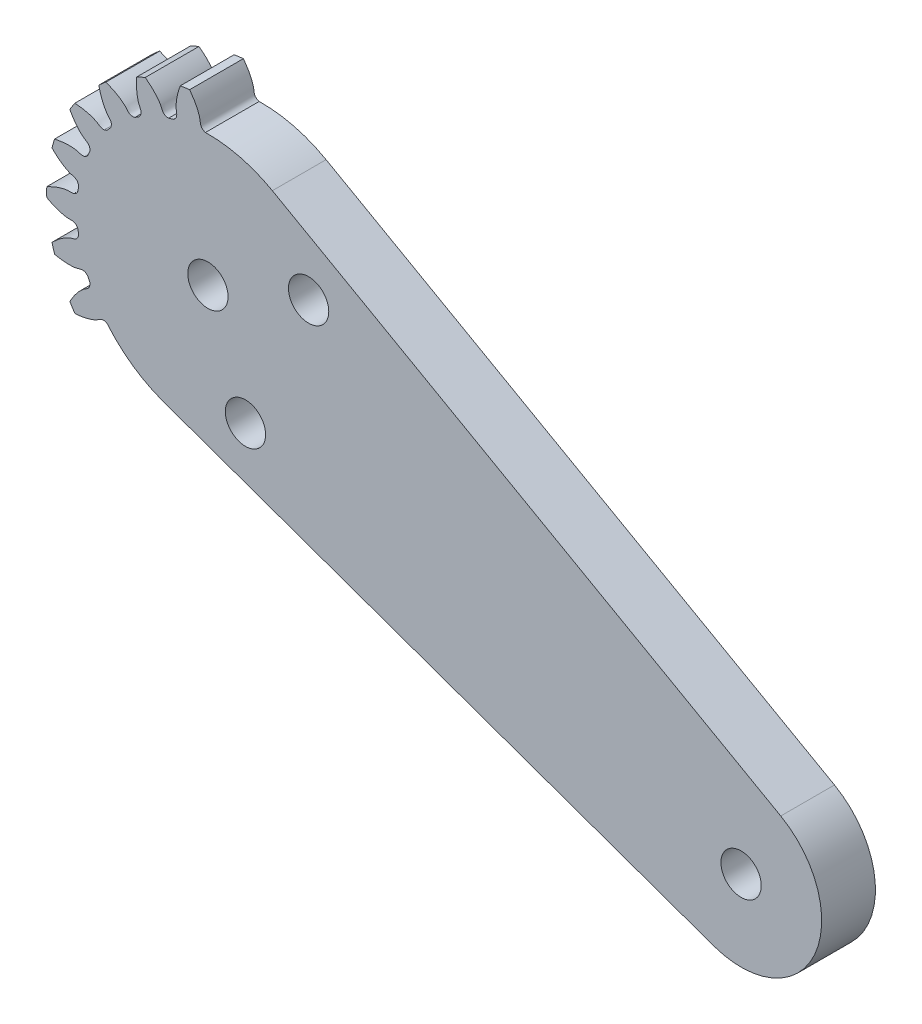
from build123d import *
from build123d.topology import SkipClean

# Parameters (mm, degrees)
SKETCH_1_R               = 12
EXTRUDE_1_DEPTH          = 4
CUT_EXTRUDE_1_DEPTH      = 18.435595774
PATTERN_CIRCULAR_1_COUNT = 9
PATTERN_CIRCULAR_1_ANGLE = 130.909090909
CUT_EXTRUDE_START        = -10
CUT_EXTRUDE_2_DEPTH      = 10
EXTRUDE_START            = -4
EXTRUDE_3_DEPTH          = 4
SKETCH_8_R               = 1.5
CUT_EXTRUDE_3_DEPTH      = 10


with BuildPart() as part:
    # 草图1 → 凸台-拉伸1 (new body)
    with BuildSketch(Plane.XY):
        Circle(SKETCH_1_R)
    extrude(amount=EXTRUDE_1_DEPTH)

    # 草图2 → 切除-拉伸1 (cut, through all)
    with BuildSketch(Plane.XY):
        with BuildLine():
            ThreePointArc((0.185665431, 9.748232063), (0, 9.75), (-0.185665431, 9.748232063))
            add(Edge.make_bspline(
                [(-0.185665431, 9.748232063), (-0.588158706, 9.876186429), (-0.548347264, 10.151774696), (-0.599584047, 10.42157039), (-0.60596118, 10.451918903), (-0.613876897, 10.486162213), (-0.623483721, 10.524250431), (-0.634939934, 10.566127653), (-0.648399943, 10.611733662), (-0.664017171, 10.661003439), (-0.681942991, 10.713867378), (-0.70232689, 10.77025128), (-0.72531626, 10.830076418), (-0.751056303, 10.893259589), (-0.779689902, 10.959713172), (-0.811357505, 11.029345185), (-0.846197011, 11.10205935), (-0.884343649, 11.177755162), (-0.925929868, 11.25632795), (-0.971085225, 11.337668957), (-1.019936271, 11.421665408), (-1.072606448, 11.508200591), (-1.129215979, 11.597153935), (-1.189881763, 11.688401095), (-1.254717274, 11.781814033), (-1.323832459, 11.877261111), (-1.397333644, 11.974607178), (-1.475323431, 12.073713662), (-1.557900608, 12.174438668), (-1.64516006, 12.276637076), (-1.737192673, 12.380160638), (-1.834085256, 12.484858081), (-1.935920447, 12.590575215), (-2.042776642, 12.697155033), (-2.154727905, 12.804437827), (-2.271843904, 12.912261294), (-2.394189822, 13.020460649), (-2.521826308, 13.128868741), (-2.654809363, 13.237316171), (-2.841488127, 13.383435539), (-2.986445715, 13.489968103), (-3.085558798, 13.559868128)],
                knots=[0, 0, 0, 0, 0.157021319, 0.162530984, 0.168888289, 0.176093235, 0.184145822, 0.19304605, 0.202793918, 0.213389427, 0.224832576, 0.237123367, 0.250261798, 0.264247869, 0.279081582, 0.294762935, 0.311291928, 0.328668563, 0.346892838, 0.365964754, 0.38588431, 0.406651508, 0.428266346, 0.450728824, 0.474038944, 0.498196704, 0.523202104, 0.549055146, 0.575755828, 0.603304151, 0.631700114, 0.660943719, 0.691034964, 0.721973849, 0.753760376, 0.786394543, 0.819876351, 0.854205799, 0.889382888, 0.925407618, 1, 1, 1, 1], degree=3))
            ThreePointArc((-3.085558798, 13.559868128), (0, 13.906498364), (3.085558798, 13.559868128))
            add(Edge.make_bspline(
                [(0.185665431, 9.748232063), (0.588158706, 9.876186429), (0.548347264, 10.151774696), (0.599584047, 10.42157039), (0.60596118, 10.451918903), (0.613876897, 10.486162213), (0.623483721, 10.524250431), (0.634939934, 10.566127653), (0.648399943, 10.611733662), (0.664017171, 10.661003439), (0.681942991, 10.713867378), (0.70232689, 10.77025128), (0.72531626, 10.830076418), (0.751056303, 10.893259589), (0.779689902, 10.959713172), (0.811357505, 11.029345185), (0.846197011, 11.10205935), (0.884343649, 11.177755162), (0.925929868, 11.25632795), (0.971085225, 11.337668957), (1.019936271, 11.421665408), (1.072606448, 11.508200591), (1.129215979, 11.597153935), (1.189881763, 11.688401095), (1.254717274, 11.781814033), (1.323832459, 11.877261111), (1.397333644, 11.974607178), (1.475323431, 12.073713662), (1.557900608, 12.174438668), (1.64516006, 12.276637076), (1.737192673, 12.380160638), (1.834085256, 12.484858081), (1.935920447, 12.590575215), (2.042776642, 12.697155033), (2.154727905, 12.804437827), (2.271843904, 12.912261294), (2.394189822, 13.020460649), (2.521826308, 13.128868741), (2.654809363, 13.237316171), (2.841488127, 13.383435539), (2.986445715, 13.489968103), (3.085558798, 13.559868128)],
                knots=[0, 0, 0, 0, 0.157021319, 0.162530984, 0.168888289, 0.176093235, 0.184145822, 0.19304605, 0.202793918, 0.213389427, 0.224832576, 0.237123367, 0.250261798, 0.264247869, 0.279081582, 0.294762935, 0.311291928, 0.328668563, 0.346892838, 0.365964754, 0.38588431, 0.406651508, 0.428266346, 0.450728824, 0.474038944, 0.498196704, 0.523202104, 0.549055146, 0.575755828, 0.603304151, 0.631700114, 0.660943719, 0.691034964, 0.721973849, 0.753760376, 0.786394543, 0.819876351, 0.854205799, 0.889382888, 0.925407618, 1, 1, 1, 1], degree=3))
        make_face()
    cut_extrude_1 = extrude(amount=CUT_EXTRUDE_1_DEPTH, mode=Mode.SUBTRACT)

    # 阵列(圆周)1: 切除-拉伸1 ×9 about axis
    pattern_circular_1_axis = Axis((0, 0, -0.2), (0, 0, 1))
    for i in range(1, PATTERN_CIRCULAR_1_COUNT):
        add(cut_extrude_1.rotate(pattern_circular_1_axis, i * PATTERN_CIRCULAR_1_ANGLE / (PATTERN_CIRCULAR_1_COUNT - 1)), mode=Mode.SUBTRACT)

    # 草图5 → 切除-拉伸2 (cut)
    with SkipClean():  # the faces are left unmerged after this step: merging them gives an invalid solid
        with BuildSketch(Plane.XY.offset(4).offset(CUT_EXTRUDE_START)):
            with BuildLine():
                Line((-7.385078482, -6.365776922), (-10.74363965, -9.260783553))
                ThreePointArc((-10.74363965, -9.260783553), (12.718980171, -6.337975406), (0.975158262, 14.183232728))
                Line((0.975158262, 14.183232728), (0, 9.75))
                ThreePointArc((0, 9.75), (8.863656835, -4.061783784), (-7.385078482, -6.365776922))
            make_face()
        extrude(amount=CUT_EXTRUDE_2_DEPTH, mode=Mode.SUBTRACT)

    # 草图6 → 凸台-拉伸3 (add)
    with SkipClean():  # the faces are left unmerged after this step: merging them gives an invalid solid
        with BuildSketch(Plane.XY.offset(4).offset(EXTRUDE_START)):
            with BuildLine():
                ThreePointArc((4.797591335, 8.487968979), (9.27336792, 3.011170442), (8.868911955, -4.050296377))
                Line((8.868911955, -4.050296377), (45.145035929, -20.617047095))
                ThreePointArc((45.145035929, -20.617047095), (45.393931908, -16.271529053), (42.639607856, -12.901191492))
                Line((42.639607856, -12.901191492), (4.797591335, 8.487968979))
            make_face()
            with BuildLine():
                Line((45.145035929, -20.617047095), (8.868911955, -4.050296377))
                ThreePointArc((8.868911955, -4.050296377), (3.797073742, -8.980241143), (-3.27302476, -9.184215204))
                Line((-3.27302476, -9.184215204), (37.673074874, -23.776381758))
                ThreePointArc((37.673074874, -23.776381758), (42.023904722, -23.650859259), (45.145035929, -20.617047095))
            make_face()
        extrude(amount=EXTRUDE_3_DEPTH)

    # 草图8 → 切除-拉伸3 (cut)
    with SkipClean():  # the faces are left unmerged after this step: merging them gives an invalid solid
        with BuildSketch(Plane.XY.offset(4)):
            with Locations((39.687243957, -18.124557017)):
                Circle(SKETCH_8_R)
            with Locations((2.795713437, -7.4955978)):
                Circle(SKETCH_8_R)
            with Locations((7.4955978, 2.795713437)):
                Circle(SKETCH_8_R)
            Circle(SKETCH_8_R)
        extrude(amount=-CUT_EXTRUDE_3_DEPTH, mode=Mode.SUBTRACT)


solid = part.part
